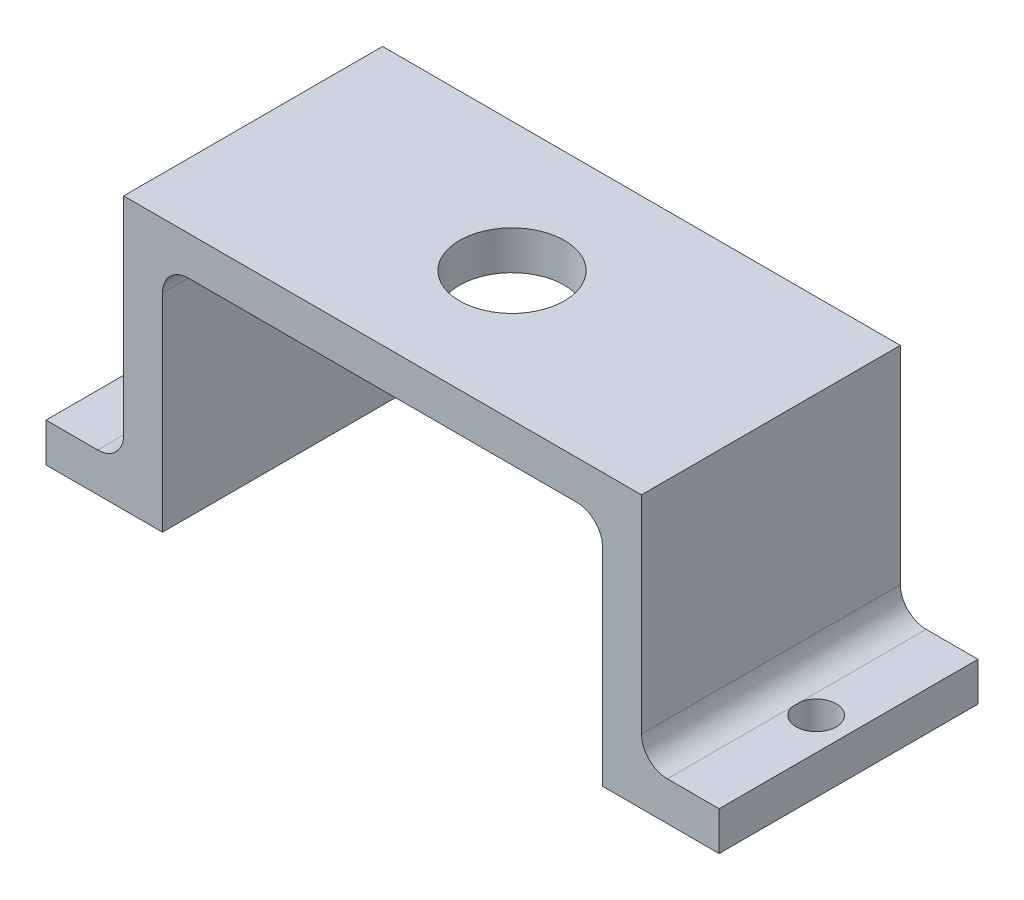
from build123d import *

# Parameters (mm, degrees)
BOSS_EXTRUDE1_DEPTH = 20
SKETCH2_R           = 4.05
CUT_EXTRUDE1_DEPTH  = 16
FILLET1_R           = 2
SKETCH3_R           = 1.55
CUT_EXTRUDE2_DEPTH  = 16


with BuildPart() as part:
    # Sketch1 → Boss-Extrude1 (new body)
    with BuildSketch(Plane.XY):
        Polygon((-17, -8.864115169), (-26, -8.864115169), (-26, -5.864115169), (-20, -5.864115169), (-20, 12.135884831), (20, 12.135884831), (20, -5.864115169), (26, -5.864115169), (26, -8.864115169), (17, -8.864115169), (17, 9.135884831), (-17, 9.135884831), align=None)
    extrude(amount=BOSS_EXTRUDE1_DEPTH)

    # Sketch2 → Cut-Extrude1 (cut)
    with BuildSketch(Plane(origin=(0, 12.135884831, 0), x_dir=(1, 0, 0), z_dir=(0, 1, 0))):
        with Locations(Location((0, -10, 0), (0, 0, 270))):
            Circle(SKETCH2_R)
    extrude(amount=-CUT_EXTRUDE1_DEPTH, mode=Mode.SUBTRACT)

    # Fillet1
    fillet1_edges = [part.edges().sort_by_distance(p)[0] for p in [
        (-20, -5.864115169, 10),
        (20, -5.864115169, 10),
        (17, 9.135884831, 10),
        (-17, 9.135884831, 10),
    ]]
    fillet(fillet1_edges, radius=FILLET1_R)

    # Sketch3 → Cut-Extrude2 (cut)
    with BuildSketch(Plane(origin=(0, -5.864115169, 0), x_dir=(1, 0, 0), z_dir=(0, 1, 0))):
        with Locations(Location((-23.5, -10, 0), (0, 0, 345.407449398))):
            Circle(SKETCH3_R)
        with Locations(Location((23.5, -10, 0), (0, 0, 194.592550602))):
            Circle(SKETCH3_R)
    extrude(amount=-CUT_EXTRUDE2_DEPTH, mode=Mode.SUBTRACT)


solid = part.part
